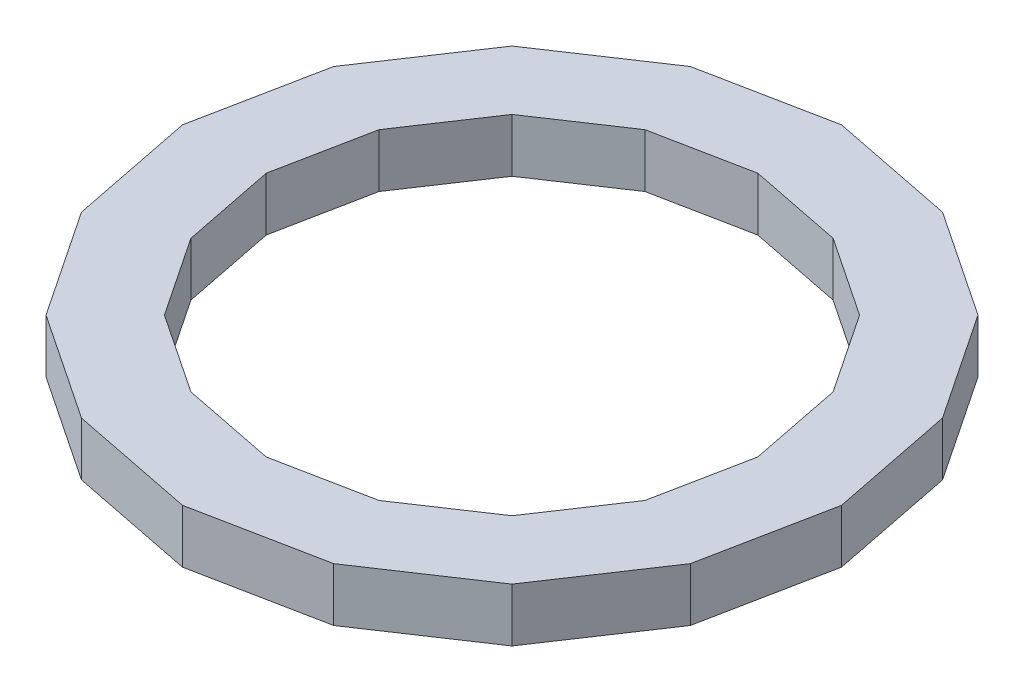
from build123d import *

# Parameters (mm, degrees)
BOSS_EXTRUDE1_DEPTH = 19.05


with BuildPart() as part:
    # Sketch1 → Boss-Extrude1 (new body)
    with BuildSketch(Plane(origin=(0, 0, 0), x_dir=(1, 0, 0), z_dir=(0, 1, 0))):
        Polygon((117.176494271, 0), (108.256964748, 44.84150302), (82.856293695, 82.856293695), (44.84150302, 108.256964748), (0, 117.176494271), (-44.84150302, 108.256964748), (-82.856293695, 82.856293695), (-108.256964748, 44.84150302), (-117.176494271, 0), (-108.256964748, -44.84150302), (-82.856293695, -82.856293695), (-44.84150302, -108.256964748), (0, -117.176494271), (44.84150302, -108.256964748), (82.856293695, -82.856293695), (108.256964748, -44.84150302), align=None)
        Polygon((87.394236539, 0), (80.741746398, 33.444326408), (61.797057294, 61.797057294), (33.444326408, 80.741746398), (0, 87.394236539), (-33.444326408, 80.741746398), (-61.797057294, 61.797057294), (-80.741746398, 33.444326408), (-87.394236539, 0), (-80.741746398, -33.444326408), (-61.797057294, -61.797057294), (-33.444326408, -80.741746398), (0, -87.394236539), (33.444326408, -80.741746398), (61.797057294, -61.797057294), (80.741746398, -33.444326408), align=None, mode=Mode.SUBTRACT)
    extrude(amount=BOSS_EXTRUDE1_DEPTH)


solid = part.part
